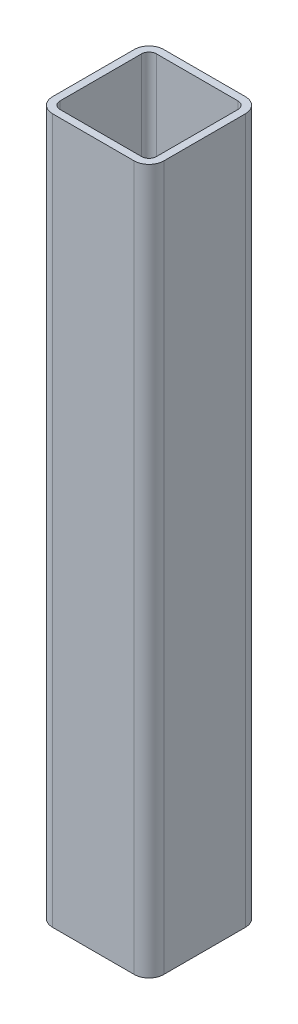
from build123d import *

# Parameters (mm, degrees)
EXTRUDE_1_DEPTH = 95


with BuildPart() as part:
    # 草图1 → 凸台-拉伸1 (new, symmetric)
    with BuildSketch(Plane(origin=(0, 0, 0), x_dir=(1, 0, 0), z_dir=(0, 1, 0))):
        with BuildLine():
            Line((4, 0), (26, 0))
            ThreePointArc((26, 0), (28.828427125, 1.171572875), (30, 4))
            Line((30, 4), (30, 26))
            ThreePointArc((30, 26), (28.828427125, 28.828427125), (26, 30))
            Line((26, 30), (4, 30))
            ThreePointArc((4, 30), (1.171572875, 28.828427125), (0, 26))
            Line((0, 26), (0, 4))
            ThreePointArc((0, 4), (1.171572875, 1.171572875), (4, 0))
        make_face()
        with BuildLine():
            Line((4, 2), (26, 2))
            ThreePointArc((26, 2), (27.414213562, 2.585786438), (28, 4))
            Line((28, 4), (28, 26))
            ThreePointArc((28, 26), (27.414213562, 27.414213562), (26, 28))
            Line((26, 28), (4, 28))
            ThreePointArc((4, 28), (2.585786438, 27.414213562), (2, 26))
            Line((2, 26), (2, 4))
            ThreePointArc((2, 4), (2.585786438, 2.585786438), (4, 2))
        make_face(mode=Mode.SUBTRACT)
    extrude(amount=EXTRUDE_1_DEPTH, both=True)


solid = part.part
